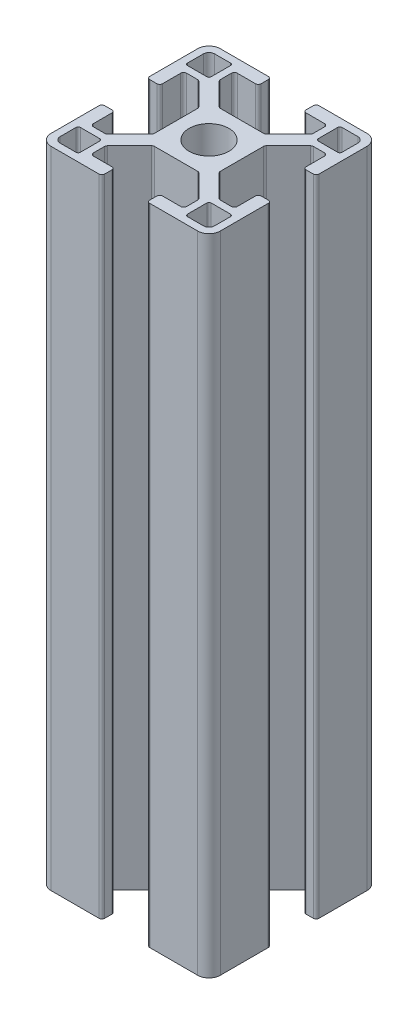
from build123d import *

# Parameters (mm, degrees)
SKETCH1_R           = 3.52998588
BOSS_EXTRUDE1_DEPTH = 57.15


with BuildPart() as part:
    # Sketch1 → Boss-Extrude1 (new, symmetric)
    with BuildSketch(Plane(origin=(0, 0, 0), x_dir=(1, 0, 0), z_dir=(0, 1, 0))):
        with BuildLine():
            Line((14.49994, -4), (13.24247465, -4))
            ThreePointArc((13.24247465, -4), (12.88892126, -4.146446609), (12.74247465, -4.5))
            Line((12.74247465, -4.5), (12.74247465, -7.732519321))
            ThreePointArc((12.74247465, -7.732519321), (12.602449697, -8.097296796), (12.242781236, -8.249967))
            Line((12.242781236, -8.249967), (10.260188032, -8.249967))
            ThreePointArc((10.260188032, -8.249967), (10.068847082, -8.211906919), (9.906636056, -8.103520976))
            Line((9.906636056, -8.103520976), (5.981117769, -4.178002689))
            ThreePointArc((5.981117769, -4.178002689), (5.872731827, -4.015791664), (5.834671745, -3.824450713))
            Line((5.834671745, -3.824450713), (5.834671745, -1.01249595))
            Line((5.834671745, -1.01249595), (5.834671745, 0.88749645))
            Line((5.834671745, 0.88749645), (5.834671745, 3.824450713))
            ThreePointArc((5.834671745, 3.824450713), (5.872731827, 4.015791664), (5.981117769, 4.178002689))
            Line((5.981117769, 4.178002689), (9.906636056, 8.103520976))
            ThreePointArc((9.906636056, 8.103520976), (10.068847082, 8.211906919), (10.260188032, 8.249967))
            Line((10.260188032, 8.249967), (12.242781236, 8.249967))
            ThreePointArc((12.242781236, 8.249967), (12.602449697, 8.097296796), (12.74247465, 7.732519321))
            Line((12.74247465, 7.732519321), (12.74247465, 4.5))
            ThreePointArc((12.74247465, 4.5), (12.88892126, 4.146446609), (13.24247465, 4))
            Line((13.24247465, 4), (14.49994, 4))
            ThreePointArc((14.49994, 4), (14.853493391, 4.146446609), (14.99994, 4.5))
            Line((14.99994, 4.5), (14.99994, 12.999948))
            ThreePointArc((14.99994, 12.999948), (14.414155906, 14.414155906), (12.999948, 14.99994))
            Line((12.999948, 14.99994), (4.5, 14.99994))
            ThreePointArc((4.5, 14.99994), (4.146446609, 14.853493391), (4, 14.49994))
            Line((4, 14.49994), (4, 13.24247465))
            ThreePointArc((4, 13.24247465), (4.146446609, 12.88892126), (4.5, 12.74247465))
            Line((4.5, 12.74247465), (7.732519321, 12.74247465))
            ThreePointArc((7.732519321, 12.74247465), (8.097296796, 12.602449697), (8.249967, 12.242781236))
            Line((8.249967, 12.242781236), (8.249967, 10.260188032))
            ThreePointArc((8.249967, 10.260188032), (8.211906919, 10.068847082), (8.103520976, 9.906636056))
            Line((8.103520976, 9.906636056), (4.178002689, 5.981117769))
            ThreePointArc((4.178002689, 5.981117769), (4.015791664, 5.872731827), (3.824450713, 5.834671745))
            Line((3.824450713, 5.834671745), (0.9499962, 5.834671745))
            Line((0.9499962, 5.834671745), (-0.9499962, 5.834671745))
            Line((-0.9499962, 5.834671745), (-3.824450713, 5.834671745))
            ThreePointArc((-3.824450713, 5.834671745), (-4.015791664, 5.872731827), (-4.178002689, 5.981117769))
            Line((-4.178002689, 5.981117769), (-8.103520976, 9.906636056))
            ThreePointArc((-8.103520976, 9.906636056), (-8.211906919, 10.068847082), (-8.249967, 10.260188032))
            Line((-8.249967, 10.260188032), (-8.249967, 12.242781236))
            ThreePointArc((-8.249967, 12.242781236), (-8.097296796, 12.602449697), (-7.732519321, 12.74247465))
            Line((-7.732519321, 12.74247465), (-4.5, 12.74247465))
            ThreePointArc((-4.5, 12.74247465), (-4.146446609, 12.88892126), (-4, 13.24247465))
            Line((-4, 13.24247465), (-4, 14.49994))
            ThreePointArc((-4, 14.49994), (-4.146446609, 14.853493391), (-4.5, 14.99994))
            Line((-4.5, 14.99994), (-12.999948, 14.99994))
            ThreePointArc((-12.999948, 14.99994), (-14.414155906, 14.414155906), (-14.99994, 12.999948))
            Line((-14.99994, 12.999948), (-14.99994, 4.5))
            ThreePointArc((-14.99994, 4.5), (-14.853493391, 4.146446609), (-14.49994, 4))
            Line((-14.49994, 4), (-13.24247465, 4))
            ThreePointArc((-13.24247465, 4), (-12.88892126, 4.146446609), (-12.74247465, 4.5))
            Line((-12.74247465, 4.5), (-12.74247465, 7.732519321))
            ThreePointArc((-12.74247465, 7.732519321), (-12.602449697, 8.097296796), (-12.242781236, 8.249967))
            Line((-12.242781236, 8.249967), (-10.260188032, 8.249967))
            ThreePointArc((-10.260188032, 8.249967), (-10.068847082, 8.211906919), (-9.906636056, 8.103520976))
            Line((-9.906636056, 8.103520976), (-5.981117769, 4.178002689))
            ThreePointArc((-5.981117769, 4.178002689), (-5.872731827, 4.015791664), (-5.834671745, 3.824450713))
            Line((-5.834671745, 3.824450713), (-5.834671745, 0.88749645))
            Line((-5.834671745, 0.88749645), (-5.834671745, -1.01249595))
            Line((-5.834671745, -1.01249595), (-5.834671745, -3.824450713))
            ThreePointArc((-5.834671745, -3.824450713), (-5.872731827, -4.015791664), (-5.981117769, -4.178002689))
            Line((-5.981117769, -4.178002689), (-9.906636056, -8.103520976))
            ThreePointArc((-9.906636056, -8.103520976), (-10.068847082, -8.211906919), (-10.260188032, -8.249967))
            Line((-10.260188032, -8.249967), (-12.242781236, -8.249967))
            ThreePointArc((-12.242781236, -8.249967), (-12.602449697, -8.097296796), (-12.74247465, -7.732519321))
            Line((-12.74247465, -7.732519321), (-12.74247465, -4.5))
            ThreePointArc((-12.74247465, -4.5), (-12.88892126, -4.146446609), (-13.24247465, -4))
            Line((-13.24247465, -4), (-14.49994, -4))
            ThreePointArc((-14.49994, -4), (-14.853493391, -4.146446609), (-14.99994, -4.5))
            Line((-14.99994, -4.5), (-14.99994, -12.999948))
            ThreePointArc((-14.99994, -12.999948), (-14.414155906, -14.414155906), (-12.999948, -14.99994))
            Line((-12.999948, -14.99994), (-4.5, -14.99994))
            ThreePointArc((-4.5, -14.99994), (-4.146446609, -14.853493391), (-4, -14.49994))
            Line((-4, -14.49994), (-4, -13.24247465))
            ThreePointArc((-4, -13.24247465), (-4.146446609, -12.88892126), (-4.5, -12.74247465))
            Line((-4.5, -12.74247465), (-7.732519321, -12.74247465))
            ThreePointArc((-7.732519321, -12.74247465), (-8.097296796, -12.602449697), (-8.249967, -12.242781236))
            Line((-8.249967, -12.242781236), (-8.249967, -10.260188032))
            ThreePointArc((-8.249967, -10.260188032), (-8.211906919, -10.068847082), (-8.103520976, -9.906636056))
            Line((-8.103520976, -9.906636056), (-4.178002689, -5.981117769))
            ThreePointArc((-4.178002689, -5.981117769), (-4.015791664, -5.872731827), (-3.824450713, -5.834671745))
            Line((-3.824450713, -5.834671745), (-0.9499962, -5.834671745))
            Line((-0.9499962, -5.834671745), (0.9499962, -5.834671745))
            Line((0.9499962, -5.834671745), (3.824450713, -5.834671745))
            ThreePointArc((3.824450713, -5.834671745), (4.015791664, -5.872731827), (4.178002689, -5.981117769))
            Line((4.178002689, -5.981117769), (8.103520976, -9.906636056))
            ThreePointArc((8.103520976, -9.906636056), (8.211906919, -10.068847082), (8.249967, -10.260188032))
            Line((8.249967, -10.260188032), (8.249967, -12.242781236))
            ThreePointArc((8.249967, -12.242781236), (8.097296796, -12.602449697), (7.732519321, -12.74247465))
            Line((7.732519321, -12.74247465), (4.5, -12.74247465))
            ThreePointArc((4.5, -12.74247465), (4.146446609, -12.88892126), (4, -13.24247465))
            Line((4, -13.24247465), (4, -14.49994))
            ThreePointArc((4, -14.49994), (4.146446609, -14.853493391), (4.5, -14.99994))
            Line((4.5, -14.99994), (12.999948, -14.99994))
            ThreePointArc((12.999948, -14.99994), (14.414155906, -14.414155906), (14.99994, -12.999948))
            Line((14.99994, -12.999948), (14.99994, -4.5))
            ThreePointArc((14.99994, -4.5), (14.853493391, -4.146446609), (14.49994, -4))
        make_face()
        with Locations(Location((0, 0, 0), (0, 0, 270))):
            Circle(SKETCH1_R, mode=Mode.SUBTRACT)
        with BuildLine():
            Line((-12.6999492, -13.6999452), (-9.880960476, -13.6999452))
            ThreePointArc((-9.880960476, -13.6999452), (-9.61155387, -13.58835333), (-9.499962, -13.318946724))
            Line((-9.499962, -13.318946724), (-9.499962, -9.87996048))
            ThreePointArc((-9.499962, -9.87996048), (-9.611260978, -9.611260978), (-9.87996048, -9.499962))
            Line((-9.87996048, -9.499962), (-13.318946724, -9.499962))
            ThreePointArc((-13.318946724, -9.499962), (-13.58835333, -9.61155387), (-13.6999452, -9.880960476))
            Line((-13.6999452, -9.880960476), (-13.6999452, -12.6999492))
            ThreePointArc((-13.6999452, -12.6999492), (-13.407053153, -13.407053153), (-12.6999492, -13.6999452))
        make_face(mode=Mode.SUBTRACT)
        with BuildLine():
            Line((13.6999452, -12.6999492), (13.6999452, -9.880960476))
            ThreePointArc((13.6999452, -9.880960476), (13.58835333, -9.61155387), (13.318946724, -9.499962))
            Line((13.318946724, -9.499962), (9.87996048, -9.499962))
            ThreePointArc((9.87996048, -9.499962), (9.611260978, -9.611260978), (9.499962, -9.87996048))
            Line((9.499962, -9.87996048), (9.499962, -13.318946724))
            ThreePointArc((9.499962, -13.318946724), (9.61155387, -13.58835333), (9.880960476, -13.6999452))
            Line((9.880960476, -13.6999452), (12.6999492, -13.6999452))
            ThreePointArc((12.6999492, -13.6999452), (13.407053153, -13.407053153), (13.6999452, -12.6999492))
        make_face(mode=Mode.SUBTRACT)
        with BuildLine():
            Line((9.87996048, 9.499962), (13.318946724, 9.499962))
            ThreePointArc((13.318946724, 9.499962), (13.58835333, 9.61155387), (13.6999452, 9.880960476))
            Line((13.6999452, 9.880960476), (13.6999452, 12.6999492))
            ThreePointArc((13.6999452, 12.6999492), (13.407053153, 13.407053153), (12.6999492, 13.6999452))
            Line((12.6999492, 13.6999452), (9.880960476, 13.6999452))
            ThreePointArc((9.880960476, 13.6999452), (9.61155387, 13.58835333), (9.499962, 13.318946724))
            Line((9.499962, 13.318946724), (9.499962, 9.87996048))
            ThreePointArc((9.499962, 9.87996048), (9.611260978, 9.611260978), (9.87996048, 9.499962))
        make_face(mode=Mode.SUBTRACT)
        with BuildLine():
            Line((-13.6999452, 12.6999492), (-13.6999452, 9.880960476))
            ThreePointArc((-13.6999452, 9.880960476), (-13.58835333, 9.61155387), (-13.318946724, 9.499962))
            Line((-13.318946724, 9.499962), (-9.87996048, 9.499962))
            ThreePointArc((-9.87996048, 9.499962), (-9.611260978, 9.611260978), (-9.499962, 9.87996048))
            Line((-9.499962, 9.87996048), (-9.499962, 13.318946724))
            ThreePointArc((-9.499962, 13.318946724), (-9.61155387, 13.58835333), (-9.880960476, 13.6999452))
            Line((-9.880960476, 13.6999452), (-12.6999492, 13.6999452))
            ThreePointArc((-12.6999492, 13.6999452), (-13.407053153, 13.407053153), (-13.6999452, 12.6999492))
        make_face(mode=Mode.SUBTRACT)
    extrude(amount=BOSS_EXTRUDE1_DEPTH, both=True)


solid = part.part
